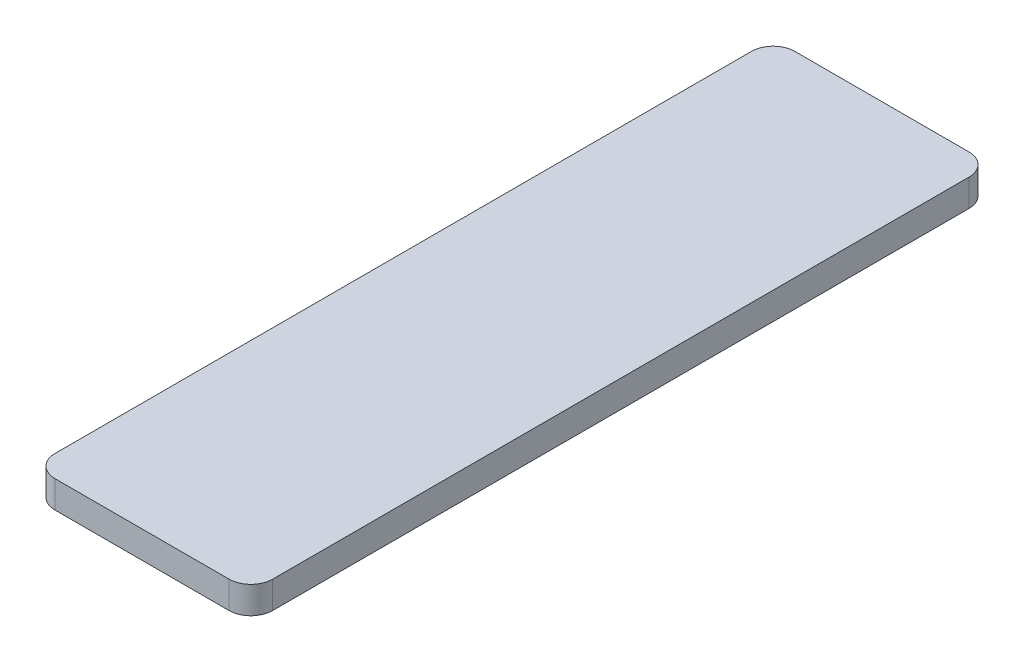
from build123d import *

# Parameters (mm, degrees)
SKETCH1_W           = 25.4
SKETCH1_H           = 86.35
BOSS_EXTRUDE1_DEPTH = 3.175
FILLET1_R           = 2.54


with BuildPart() as part:
    # Sketch1 → Boss-Extrude1 (new body)
    with BuildSketch(Plane(origin=(0, 0, 0), x_dir=(1, 0, 0), z_dir=(0, 1, 0))):
        with Locations((-13.581081081, 13.041216216)):
            Rectangle(SKETCH1_W, SKETCH1_H)
    extrude(amount=BOSS_EXTRUDE1_DEPTH)

    # Fillet1
    fillet1_edges = [part.edges().sort_by_distance(p)[0] for p in [
        (-26.281081081, 1.5875, -56.216216216),
        (-0.881081081, 1.5875, -56.216216216),
        (-0.881081081, 1.5875, 30.133783784),
        (-26.281081081, 1.5875, 30.133783784),
    ]]
    fillet(fillet1_edges, radius=FILLET1_R)


solid = part.part
